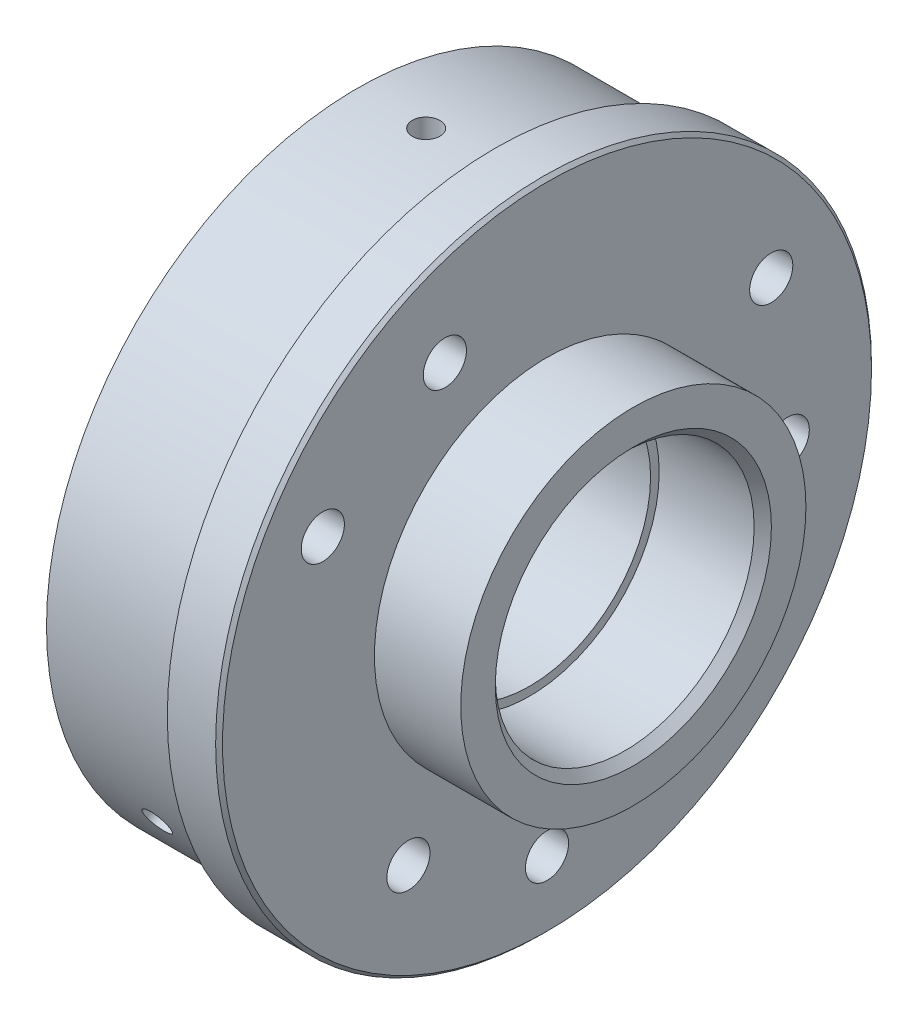
from build123d import *

# Parameters (mm, degrees)
BASES_R                  = 19
BASE_DEPTH               = 3
WALLS_R                  = 10
WALLS_R_2                = 7.5
WALL_DEPTH               = 5
FASTENINGBODYS_R         = 18
FASTENINGBODY_DEPTH      = 8
CIRPATTERN1_COUNT        = 3
BEARINGACCESSBORES_R     = 7
BEARINGACCESSBORE_DEPTH  = 30.03446232
ADDITIONALDEPTHCUT_START = -1
ADDITIONALDEPTHCUTS_R    = 7.5
ADDITIONALDEPTHCUT_DEPTH = 1
CIRPATTERN2_COUNT        = 3
CIRPATTERN3_COUNT        = 3
CHAMFER1_SIZE            = 0.5
CHAMFER2_SIZE            = 0.2


with BuildPart() as part:
    # BaseS → Base (new body)
    with BuildSketch(Plane(origin=(0, 0, 0), x_dir=(0, 0, -1), z_dir=(1, 0, 0))):
        Circle(BASES_R)
    extrude(amount=BASE_DEPTH)

    # WallS → Wall (add)
    with BuildSketch(Plane(origin=(3, 0, 0), x_dir=(0, 0, -1), z_dir=(1, 0, 0))):
        Circle(WALLS_R)
        Circle(WALLS_R_2, mode=Mode.SUBTRACT)
    extrude(amount=WALL_DEPTH)

    # FasteningBodyS → FasteningBody (add)
    with BuildSketch(Plane.ZY):
        Circle(FASTENINGBODYS_R)
    extrude(amount=FASTENINGBODY_DEPTH)

    # Sketch5 → M2x0.4 Tapped Hole1 (revolve, cut)
    with BuildSketch(Plane(origin=(-4, 18, 0), x_dir=(0, 0, 1), z_dir=(1, 0, 0))):
        Polygon((0, 0), (0, 5.680688495), (0.8, 5.2), (0.8, 0), align=None)
    m2x0_4_tapped_hole1 = revolve(axis=Axis((-4, 24.35, 0), (0, -1, 0)), mode=Mode.SUBTRACT)

    # CirPattern1: M2x0.4 Tapped Hole1 ×3 about axis
    cirpattern1_axis = Axis((-8, 0, 0), (1, 0, 0))
    for i in range(1, CIRPATTERN1_COUNT):
        add(m2x0_4_tapped_hole1.rotate(cirpattern1_axis, i * 360 / CIRPATTERN1_COUNT), mode=Mode.SUBTRACT)

    # BearingAccessBoreS → BearingAccessBore (cut, through all)
    with BuildSketch(Plane(origin=(3, 0, 0), x_dir=(0, 0, -1), z_dir=(1, 0, 0))):
        Circle(BEARINGACCESSBORES_R)
    extrude(amount=-BEARINGACCESSBORE_DEPTH, mode=Mode.SUBTRACT)

    # AdditionalDepthCutS → AdditionalDepthCut (cut)
    with BuildSketch(Plane(origin=(3, 0, 0), x_dir=(0, 0, -1), z_dir=(1, 0, 0)).offset(ADDITIONALDEPTHCUT_START)):
        Circle(ADDITIONALDEPTHCUTS_R)
    extrude(amount=ADDITIONALDEPTHCUT_DEPTH, mode=Mode.SUBTRACT)

    # Sketch11 → M3x0.5 Tapped Hole2 (revolve, cut)
    with BuildSketch(Plane(origin=(3, -15, 0), x_dir=(0, 0, -1), z_dir=(0, 1, 0))):
        Polygon((0, 0), (0, 8.251075774), (1.25, 7.5), (1.25, 0), align=None)
    m3x0_5_tapped_hole2 = revolve(axis=Axis((9.35, -15, 0), (-1, 0, 0)), mode=Mode.SUBTRACT)

    # Sketch8 → M3x0.5 Tapped Hole1 (revolve, cut)
    with BuildSketch(Plane(origin=(3, -11.46812862, 8.030070109), x_dir=(0, 0, -1), z_dir=(0, 1, 0))):
        Polygon((0, 0), (0, 8.251075774), (1.25, 7.5), (1.25, 0), align=None)
    m3x0_5_tapped_hole1 = revolve(axis=Axis((9.35, -11.46812862, 8.030070109), (-1, 0, 0)), mode=Mode.SUBTRACT)

    # CirPattern2: M3x0.5 Tapped Hole1 ×3 about axis
    cirpattern2_axis = Axis((0, 0, 0), (1, 0, 0))
    for i in range(1, CIRPATTERN2_COUNT):
        add(m3x0_5_tapped_hole1.rotate(cirpattern2_axis, i * 360 / CIRPATTERN2_COUNT), mode=Mode.SUBTRACT)

    # CirPattern3: M3x0.5 Tapped Hole2 ×3 about axis
    cirpattern3_axis = Axis((0, 0, 0), (1, 0, 0))
    for i in range(1, CIRPATTERN3_COUNT):
        add(m3x0_5_tapped_hole2.rotate(cirpattern3_axis, i * 360 / CIRPATTERN3_COUNT), mode=Mode.SUBTRACT)

    # Chamfer1
    chamfer1_edges = [part.edges().sort_by_distance(p)[0] for p in [
        (8, 0, 7.5),
    ]]
    chamfer(chamfer1_edges, length=CHAMFER1_SIZE)

    # Chamfer2
    chamfer2_edges = [part.edges().sort_by_distance(p)[0] for p in [
        (3, 0, 19),
    ]]
    chamfer(chamfer2_edges, length=CHAMFER2_SIZE)


solid = part.part
